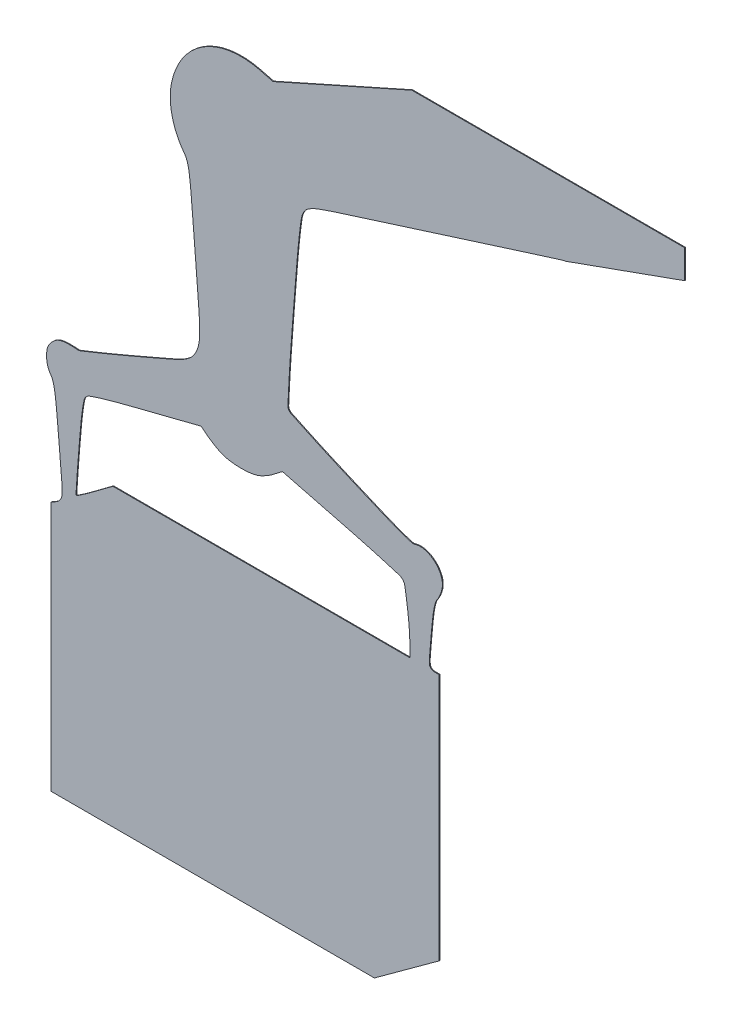
from build123d import *

# Parameters (mm, degrees)
BOSS_EXTRUDE1_DEPTH = 10
SCALE1_SCALE        = 0.046
CUT_EXTRUDE1_DEPTH  = 12692.615329405
CUT_EXTRUDE2_DEPTH  = 12517.928558279


with BuildPart() as part:
    # Sketch1 → Boss-Extrude1 (new body)
    with BuildSketch(Plane.XY):
        with BuildLine():
            Line((8013.7, 12087.9381558), (6413.5, 11374.2040232))
            Line((6413.5, 11374.2040232), (6240.4799498, 11418.3283698))
            ThreePointArc((6240.4799498, 11418.3283698), (6046.359984041, 11447.983061733), (5850.183499, 11439.2224352))
            ThreePointArc((5850.183499, 11439.2224352), (5665.088909871, 11392.106426099), (5494.1407008, 11306.9205408))
            ThreePointArc((5494.1407008, 11306.9205408), (5345.328560712, 11187.669304739), (5225.1613302, 11039.5958532))
            ThreePointArc((5225.1613302, 11039.5958532), (5135.482400316, 10865.681366374), (5081.728978, 10677.5348044))
            ThreePointArc((5081.728978, 10677.5348044), (5070.59567271, 10588.705653864), (5069.2278854, 10499.191981))
            ThreePointArc((5069.2278854, 10499.191981), (5077.452147154, 10407.059650706), (5094.7620228, 10316.1950648))
            ThreePointArc((5094.7620228, 10316.1950648), (5121.033047908, 10227.302344557), (5155.9620528, 10141.4417186))
            ThreePointArc((5155.9620528, 10141.4417186), (5198.337440796, 10061.957763243), (5249.023792, 9987.497932))
            ThreePointArc((5249.023792, 9987.497932), (5273.045317341, 9949.461029077), (5290.0090542, 9907.7948402))
            ThreePointArc((5290.0090542, 9907.7948402), (5305.17852601, 9850.504915282), (5315.782231, 9792.1970272))
            ThreePointArc((5315.782231, 9792.1970272), (5329.167785357, 9687.048159554), (5339.6477408, 9581.5700672))
            ThreePointArc((5339.6477408, 9581.5700672), (5363.840138018, 9294.925199538), (5387.437409, 9008.2307262))
            ThreePointArc((5387.437409, 9008.2307262), (5416.286522533, 8647.747745028), (5444.2516464, 8287.1951096))
            ThreePointArc((5444.2516464, 8287.1951096), (5451.43971584, 8162.289482831), (5453.9529224, 8037.2024422))
            ThreePointArc((5453.9529224, 8037.2024422), (5449.926817768, 7965.282930235), (5437.7011642, 7894.2958954))
            ThreePointArc((5437.7011642, 7894.2958954), (5418.187849305, 7832.911229395), (5389.1534584, 7775.4147006))
            ThreePointArc((5389.1534584, 7775.4147006), (5360.432474359, 7735.42584984), (5326.0360586, 7700.1995856))
            ThreePointArc((5326.0360586, 7700.1995856), (5283.671683469, 7667.035926907), (5237.7633878, 7638.9824614))
            ThreePointArc((5237.7633878, 7638.9824614), (5156.323701806, 7597.538218662), (5073.2948572, 7559.3772612))
            ThreePointArc((5073.2948572, 7559.3772612), (4841.842272606, 7458.942619321), (4610.1, 7359.1782204))
            ThreePointArc((4610.1, 7359.1782204), (4472.546974341, 7300.543613169), (4334.7457628, 7242.4946844))
            ThreePointArc((4334.7457628, 7242.4946844), (4215.84703669, 7193.169525037), (4096.623125, 7144.6356472))
            ThreePointArc((4096.623125, 7144.6356472), (3992.875825461, 7102.918226399), (3889.049118, 7061.3988312))
            ThreePointArc((3889.049118, 7061.3988312), (3875.172107017, 7057.616370579), (3860.8, 7057.0498178))
            ThreePointArc((3860.8, 7057.0498178), (3788.686277732, 7060.729199963), (3716.4796638, 7061.0921008))
            ThreePointArc((3716.4796638, 7061.0921008), (3668.670063023, 7056.686907952), (3622.0311354, 7045.2862904))
            ThreePointArc((3622.0311354, 7045.2862904), (3584.941382024, 7029.068759948), (3551.7445348, 7005.9035396))
            ThreePointArc((3551.7445348, 7005.9035396), (3517.965532838, 6973.097636949), (3488.5768938, 6936.30693))
            ThreePointArc((3488.5768938, 6936.30693), (3469.492867754, 6902.045915317), (3457.8050478, 6864.610477))
            ThreePointArc((3457.8050478, 6864.610477), (3451.280738568, 6818.108248058), (3450.4111078, 6771.1586192))
            ThreePointArc((3450.4111078, 6771.1586192), (3455.262622431, 6723.510334197), (3465.7417858, 6676.7761562))
            ThreePointArc((3465.7417858, 6676.7761562), (3480.830700287, 6637.788146337), (3502.5934266, 6602.0932728))
            ThreePointArc((3502.5934266, 6602.0932728), (3521.051484979, 6571.93189785), (3533.978962, 6539.018545))
            ThreePointArc((3533.978962, 6539.018545), (3546.631358446, 6490.474104554), (3556.1690624, 6441.2229316))
            ThreePointArc((3556.1690624, 6441.2229316), (3567.919821071, 6360.028912081), (3577.1121752, 6278.505604))
            ThreePointArc((3577.1121752, 6278.505604), (3592.554761707, 6115.030510805), (3607.2203446, 5951.4838806))
            ThreePointArc((3607.2203446, 5951.4838806), (3628.747440784, 5701.649294583), (3649.7228504, 5451.7677858))
            ThreePointArc((3649.7228504, 5451.7677858), (3653.303495344, 5384.795036587), (3652.9653382, 5317.72749))
            ThreePointArc((3652.9653382, 5317.72749), (3647.178742206, 5282.142183378), (3632.6405122, 5249.1506904))
            ThreePointArc((3632.6405122, 5249.1506904), (3610.181824588, 5220.557208509), (3581.4, 5198.3404034))
            Line((3581.4, 5198.3404034), (3505.2, 5153.3279712))
            Line((3505.2, 5153.3279712), (3505.2, 3516.4639856))
            Line((3505.2, 3516.4639856), (3505.2, 1879.6))
            Line((3505.2, 1879.6), (5622.395664, 1879.6))
            Line((5622.395664, 1879.6), (7739.5913026, 1879.6))
            Line((7739.5913026, 1879.6), (8162.395664, 2187.7570164))
            Line((8162.395664, 2187.7570164), (8585.2, 2495.9140582))
            Line((8585.2, 2495.9140582), (8585.2, 4118.1570164))
            Line((8585.2, 4118.1570164), (8585.2, 5740.4))
            Line((8585.2, 5740.4), (8521.7, 5740.4))
            ThreePointArc((8521.7, 5740.4), (8499.621736439, 5744.256845044), (8480.1586556, 5755.370506))
            ThreePointArc((8480.1586556, 5755.370506), (8466.798224941, 5771.937972142), (8460.9593798, 5792.4047728))
            ThreePointArc((8460.9593798, 5792.4047728), (8459.307495931, 5836.167616977), (8461.140685, 5879.9232414))
            ThreePointArc((8461.140685, 5879.9232414), (8473.890569662, 6032.434200774), (8487.169589, 6184.9))
            ThreePointArc((8487.169589, 6184.9), (8495.074777487, 6268.097332276), (8503.9980034, 6351.191641))
            ThreePointArc((8503.9980034, 6351.191641), (8511.311435418, 6405.689023868), (8520.831066, 6459.8446114))
            ThreePointArc((8520.831066, 6459.8446114), (8529.476237188, 6497.595691068), (8540.430214, 6534.7426074))
            ThreePointArc((8540.430214, 6534.7426074), (8551.399303065, 6561.381231615), (8566.1292482, 6586.1393804))
            ThreePointArc((8566.1292482, 6586.1393804), (8576.765103953, 6602.739954352), (8586.0423402, 6620.1363152))
            ThreePointArc((8586.0423402, 6620.1363152), (8595.916066382, 6641.825237208), (8604.7919598, 6663.9412568))
            ThreePointArc((8604.7919598, 6663.9412568), (8612.789637678, 6686.822845287), (8619.7438984, 6710.042841))
            ThreePointArc((8619.7438984, 6710.042841), (8624.615343178, 6730.497311193), (8628.0625, 6751.2393804))
            ThreePointArc((8628.0625, 6751.2393804), (8627.766889761, 6816.992622416), (8609.991162, 6880.2982282))
            ThreePointArc((8609.991162, 6880.2982282), (8575.08984436, 6941.510082371), (8527.6889898, 6993.6459822))
            ThreePointArc((8527.6889898, 6993.6459822), (8470.459185423, 7033.829045105), (8405.789259, 7060.4322342))
            ThreePointArc((8405.789259, 7060.4322342), (8341.758979586, 7069.433837567), (8277.7284788, 7060.433809))
            ThreePointArc((8277.7284788, 7060.433809), (8246.325518454, 7056.171018469), (8215.0088176, 7061.0271022))
            ThreePointArc((8215.0088176, 7061.0271022), (8142.617224989, 7084.426898938), (8070.9304926, 7109.9044492))
            ThreePointArc((8070.9304926, 7109.9044492), (7956.791154889, 7153.694426638), (7843.5905612, 7199.8569236))
            ThreePointArc((7843.5905612, 7199.8569236), (7635.475694259, 7287.737711921), (7427.6985812, 7376.4141016))
            ThreePointArc((7427.6985812, 7376.4141016), (7276.698060485, 7441.745559624), (7126.0979398, 7507.9947884))
            ThreePointArc((7126.0979398, 7507.9947884), (6996.659110434, 7566.139903041), (6867.7758758, 7625.5063644))
            ThreePointArc((6867.7758758, 7625.5063644), (6756.954102408, 7677.400860526), (6646.2949878, 7729.6413098))
            ThreePointArc((6646.2949878, 7729.6413098), (6631.295110686, 7739.554392533), (6619.6560266, 7753.258306))
            ThreePointArc((6619.6560266, 7753.258306), (6610.70551698, 7773.762227935), (6608.265422, 7796.0011212))
            ThreePointArc((6608.265422, 7796.0011212), (6613.799150605, 7920.600877676), (6619.9587946, 8045.1712604))
            ThreePointArc((6619.9587946, 8045.1712604), (6629.606037532, 8214.837445524), (6640.9083844, 8384.4014176))
            ThreePointArc((6640.9083844, 8384.4014176), (6659.557083807, 8639.604717722), (6678.9753898, 8894.7506128))
            ThreePointArc((6678.9753898, 8894.7506128), (6701.895117406, 9185.045509683), (6725.5817228, 9475.2788396))
            ThreePointArc((6725.5817228, 9475.2788396), (6740.03572912, 9636.309982298), (6756.6673858, 9797.1307994))
            ThreePointArc((6756.6673858, 9797.1307994), (6768.823209225, 9898.593531999), (6782.8884662, 9999.8092358))
            ThreePointArc((6782.8884662, 9999.8092358), (6793.251642243, 10044.911696265), (6810.5265364, 10087.8442642))
            ThreePointArc((6810.5265364, 10087.8442642), (6838.953243398, 10129.802521095), (6877.5131182, 10162.6918666))
            ThreePointArc((6877.5131182, 10162.6918666), (6937.289587601, 10196.592027706), (7000.4666442, 10223.6310132))
            ThreePointArc((7000.4666442, 10223.6310132), (7133.867205826, 10270.587865527), (7268.1976556, 10314.814397))
            ThreePointArc((7268.1976556, 10314.814397), (7926.652624623, 10524.024074559), (8585.2, 10732.9426946))
            Line((8585.2, 10732.9426946), (9724.6877134, 11094.0807074))
            ThreePointArc((9724.6877134, 11094.0807074), (9882.121991335, 11143.830554107), (10039.6334894, 11193.335373))
            ThreePointArc((10039.6334894, 11193.335373), (10126.434710134, 11220.461411642), (10213.2817578, 11247.4403702))
            ThreePointArc((10213.2817578, 11247.4403702), (10226.888408223, 11250.626221539), (10240.8073822, 11251.8723146))
            ThreePointArc((10240.8073822, 11251.8723146), (10251.605287665, 11249.71452924), (10260.5055902, 11243.2310568))
            ThreePointArc((10260.5055902, 11243.2310568), (10348.52857854, 11143.737186565), (10436.4002346, 11044.1096364))
            ThreePointArc((10436.4002346, 11044.1096364), (10573.529611947, 10887.775517933), (10710.0413434, 10730.9017792))
            ThreePointArc((10710.0413434, 10730.9017792), (11017.796401299, 10375.669808905), (11325.3922844, 10020.3))
            Line((11325.3922844, 10020.3), (11488.731023, 9831.6198846))
            Line((11488.731023, 9831.6198846), (11633.909041, 9664.1613168))
            Line((11633.909041, 9664.1613168), (11756.8074744, 9522.5883462))
            ThreePointArc((11756.8074744, 9522.5883462), (11773.014929443, 9504.045912955), (11789.3396166, 9485.6066066))
            ThreePointArc((11789.3396166, 9485.6066066), (11801.471954744, 9470.651088998), (11812.1705336, 9454.6385456))
            ThreePointArc((11812.1705336, 9454.6385456), (11818.547613602, 9441.226414023), (11822.1640874, 9426.8224722))
            ThreePointArc((11822.1640874, 9426.8224722), (11823.219249135, 9410.444508738), (11821.5623614, 9394.1164416))
            ThreePointArc((11821.5623614, 9394.1164416), (11816.411467152, 9369.864948573), (11810.0345968, 9345.9066066))
            ThreePointArc((11810.0345968, 9345.9066066), (11789.788692272, 9253.989134012), (11782.334322, 9160.1640266))
            ThreePointArc((11782.334322, 9160.1640266), (11775.675639859, 8484.016465428), (11769.9324672, 7807.8605082))
            ThreePointArc((11769.9324672, 7807.8605082), (11765.002192197, 7126.326371667), (11760.865226, 6444.786958))
            ThreePointArc((11760.865226, 6444.786958), (11766.994080455, 6363.849098465), (11786.1075936, 6284.9620046))
            ThreePointArc((11786.1075936, 6284.9620046), (11801.273658631, 6248.022209383), (11821.5014522, 6213.5926528))
            ThreePointArc((11821.5014522, 6213.5926528), (11847.009980231, 6181.136931264), (11876.4599402, 6152.2101492))
            ThreePointArc((11876.4599402, 6152.2101492), (11907.352950793, 6129.01489143), (11941.116199, 6110.2414752))
            ThreePointArc((11941.116199, 6110.2414752), (11972.235832928, 6099.603637225), (12004.9254186, 6096))
            ThreePointArc((12004.9254186, 6096), (12022.237348825, 6094.365139274), (12038.937187, 6089.5183772))
            ThreePointArc((12038.937187, 6089.5183772), (12049.714298184, 6082.264416243), (12056.4683686, 6071.167182))
            ThreePointArc((12056.4683686, 6071.167182), (12061.626567073, 6051.31204068), (12063.6880646, 6030.9016542))
            ThreePointArc((12063.6880646, 6030.9016542), (12064.671993978, 5976.025775463), (12065, 5921.1420566))
            Line((12065, 5921.1420566), (12065, 5746.2841132))
            Line((12065, 5746.2841132), (11728.45, 5735.6247238))
            ThreePointArc((11728.45, 5735.6247238), (11639.409912361, 5732.265376868), (11550.4169804, 5727.8291082))
            ThreePointArc((11550.4169804, 5727.8291082), (11492.78719336, 5723.401344301), (11435.3917342, 5716.5779496))
            ThreePointArc((11435.3917342, 5716.5779496), (11392.482951355, 5709.191580544), (11350.1206576, 5699.1338392))
            ThreePointArc((11350.1206576, 5699.1338392), (11311.76695197, 5687.09353885), (11274.490913, 5672.044536))
            ThreePointArc((11274.490913, 5672.044536), (11212.826297903, 5640.813741429), (11154.242868, 5604.1276538))
            ThreePointArc((11154.242868, 5604.1276538), (11097.403659938, 5561.248873097), (11044.3142334, 5513.8062952))
            ThreePointArc((11044.3142334, 5513.8062952), (10995.201036709, 5461.991489912), (10950.5393892, 5406.2939372))
            ThreePointArc((10950.5393892, 5406.2939372), (10911.772972589, 5348.394179623), (10878.3064628, 5287.2778176))
            Line((10878.3064628, 5287.2778176), (10807.7, 5143.5))
            Line((10807.7, 5143.5), (10800.079111, 4298.95))
            Line((10800.079111, 4298.95), (10792.4582474, 3454.4))
            Line((10792.4582474, 3454.4), (10695.5545296, 3454.4))
            ThreePointArc((10695.5545296, 3454.4), (10673.210222905, 3453.506848803), (10651.0084922, 3450.8331034))
            ThreePointArc((10651.0084922, 3450.8331034), (10628.667947463, 3446.360708838), (10606.728723, 3440.2147604))
            ThreePointArc((10606.728723, 3440.2147604), (10585.996334601, 3432.651714483), (10565.9141488, 3423.5009))
            ThreePointArc((10565.9141488, 3423.5009), (10548.275509695, 3413.484445011), (10531.7254186, 3401.756468))
            Line((10531.7254186, 3401.756468), (10464.8, 3349.112936))
            Line((10464.8, 3349.112936), (10464.8, 2906.3587796))
            Line((10464.8, 2906.3587796), (10464.8, 2463.6046486))
            Line((10464.8, 2463.6046486), (13671.55, 2470.052337))
            Line((13671.55, 2470.052337), (16878.3, 2476.5))
            Line((16878.3, 2476.5), (16878.3, 2904.191804))
            Line((16878.3, 2904.191804), (16878.3, 3331.8836334))
            Line((16878.3, 3331.8836334), (16807.0335944, 3393.141804))
            ThreePointArc((16807.0335944, 3393.141804), (16789.805423154, 3406.726225623), (16771.490206, 3418.8051004))
            ThreePointArc((16771.490206, 3418.8051004), (16752.1689091, 3429.328105309), (16732.033211, 3438.1937586))
            ThreePointArc((16732.033211, 3438.1937586), (16711.729000447, 3445.142774677), (16690.9026862, 3450.3210394))
            ThreePointArc((16690.9026862, 3450.3210394), (16670.747066545, 3453.377695343), (16650.3866382, 3454.4))
            Line((16650.3866382, 3454.4), (16565.0060368, 3454.4))
            Line((16565.0060368, 3454.4), (16556.5530184, 4288.8790016))
            Line((16556.5530184, 4288.8790016), (16548.1, 5123.3579778))
            Line((16548.1, 5123.3579778), (16459.2, 5297.5729456))
            ThreePointArc((16459.2, 5297.5729456), (16393.970241534, 5406.129975299), (16314.3836526, 5504.646598))
            ThreePointArc((16314.3836526, 5504.646598), (16228.696609606, 5581.29891545), (16130.3999972, 5640.9279612))
            ThreePointArc((16130.3999972, 5640.9279612), (16010.404259301, 5688.227315854), (15884.542907, 5716.4252956))
            ThreePointArc((15884.542907, 5716.4252956), (15717.441602781, 5734.398648806), (15549.4836584, 5740.4))
            Line((15549.4836584, 5740.4), (15265.4, 5740.4))
            Line((15265.4, 5740.4), (15265.4, 5904.5209824))
            Line((15265.4, 5904.5209824), (15265.4, 6068.6419648))
            Line((15265.4, 6068.6419648), (15365.7226086, 6095.6560332))
            ThreePointArc((15365.7226086, 6095.6560332), (15388.472859271, 6102.788960928), (15410.5661816, 6111.7520894))
            ThreePointArc((15410.5661816, 6111.7520894), (15432.236417154, 6122.623700965), (15452.9987104, 6135.142416))
            ThreePointArc((15452.9987104, 6135.142416), (15472.01252463, 6148.758650972), (15489.8749892, 6163.8536616))
            ThreePointArc((15489.8749892, 6163.8536616), (15504.839594685, 6179.086560043), (15518.1226086, 6195.8060742))
            ThreePointArc((15518.1226086, 6195.8060742), (15539.452162435, 6235.505668493), (15550.2305708, 6279.2644798))
            ThreePointArc((15550.2305708, 6279.2644798), (15558.562142107, 6366.481581122), (15563.3096912, 6453.9670006))
            ThreePointArc((15563.3096912, 6453.9670006), (15567.566790383, 6618.991725036), (15569.2131592, 6784.06314))
            ThreePointArc((15569.2131592, 6784.06314), (15569.953342364, 7262.285296995), (15570.2, 7740.5079632))
            ThreePointArc((15570.2, 7740.5079632), (15569.201322813, 8290.823937352), (15566.2050118, 8841.1326606))
            ThreePointArc((15566.2050118, 8841.1326606), (15559.936243212, 9048.055940888), (15544.1482868, 9254.4712548))
            ThreePointArc((15544.1482868, 9254.4712548), (15522.542584413, 9393.274017752), (15485.8152056, 9528.8620446))
            ThreePointArc((15485.8152056, 9528.8620446), (15429.20715326, 9681.530775028), (15361.913396, 9829.8))
            ThreePointArc((15361.913396, 9829.8), (15330.041020842, 9890.913768027), (15295.8501804, 9950.7613024))
            ThreePointArc((15295.8501804, 9950.7613024), (15263.300606357, 10001.965253413), (15227.9328156, 10051.2647336))
            ThreePointArc((15227.9328156, 10051.2647336), (15185.607808221, 10104.255502838), (15140.828113, 10155.188859))
            ThreePointArc((15140.828113, 10155.188859), (15076.9895261, 10223.14666278), (15011.8922012, 10289.8996894))
            ThreePointArc((15011.8922012, 10289.8996894), (14942.019708299, 10358.978162157), (14870.9251222, 10426.7982218))
            ThreePointArc((14870.9251222, 10426.7982218), (14821.428489438, 10470.653513786), (14769.566092, 10511.6839296))
            ThreePointArc((14769.566092, 10511.6839296), (14719.580647315, 10546.568414462), (14667.4574824, 10578.1698012))
            ThreePointArc((14667.4574824, 10578.1698012), (14598.474047126, 10615.641921358), (14528.37836, 10650.989747))
            ThreePointArc((14528.37836, 10650.989747), (14436.385896336, 10693.412411794), (14342.7936156, 10732.1781292))
            ThreePointArc((14342.7936156, 10732.1781292), (14255.550037724, 10763.764087451), (14166.8031878, 10790.840115))
            ThreePointArc((14166.8031878, 10790.840115), (14078.522226444, 10812.843634457), (13989.2088008, 10830.1870772))
            ThreePointArc((13989.2088008, 10830.1870772), (13894.308535835, 10843.865098565), (13798.8905378, 10853.2754232))
            ThreePointArc((13798.8905378, 10853.2754232), (13747.506006035, 10858.654666469), (13696.510072, 10866.944484))
            ThreePointArc((13696.510072, 10866.944484), (13661.709384014, 10876.55887704), (13628.884223, 10891.593279))
            ThreePointArc((13628.884223, 10891.593279), (13590.249794058, 10915.587637602), (13553.998927, 10943.050758))
            ThreePointArc((13553.998927, 10943.050758), (13472.90780803, 11011.288348759), (13392.4905378, 11080.3187842))
            Line((13392.4905378, 11080.3187842), (13249.18356, 11204.4861508))
            Line((13249.18356, 11204.4861508), (12978.5872254, 11438.7763858))
            Line((12978.5872254, 11438.7763858), (12661.0677182, 11713.6338244))
            Line((12661.0677182, 11713.6338244), (12331.7, 11998.6858578))
            ThreePointArc((12331.7, 11998.6858578), (12139.965515321, 12165.362002787), (11948.9830108, 12332.899261))
            ThreePointArc((11948.9830108, 12332.899261), (11819.346864421, 12448.695864363), (11691.279132, 12566.2247532))
            ThreePointArc((11691.279132, 12566.2247532), (11602.500209131, 12650.048325947), (11514.9817452, 12735.1870772))
            ThreePointArc((11514.9817452, 12735.1870772), (11478.246452113, 12776.301810119), (11446.9252392, 12821.6767442))
            ThreePointArc((11446.9252392, 12821.6767442), (11369.950543409, 12934.783861737), (11280.8380428, 13038.5975702))
            ThreePointArc((11280.8380428, 13038.5975702), (11184.469460283, 13126.844315827), (11077.6061404, 13202.041541))
            ThreePointArc((11077.6061404, 13202.041541), (10963.57284339, 13261.965467117), (10842.7128586, 13306.5449896))
            ThreePointArc((10842.7128586, 13306.5449896), (10714.383776247, 13336.198752676), (10583.3984166, 13350.0021798))
            ThreePointArc((10583.3984166, 13350.0021798), (10536.038914249, 13351.400670377), (10488.6587788, 13351.4323522))
            ThreePointArc((10488.6587788, 13351.4323522), (10443.398360002, 13350.061412745), (10398.2079564, 13347.195683))
            ThreePointArc((10398.2079564, 13347.195683), (10357.68465063, 13343.22099371), (10317.329759, 13337.797048))
            ThreePointArc((10317.329759, 13337.797048), (10284.481288182, 13331.693661966), (10252.0934658, 13323.489863))
            ThreePointArc((10252.0934658, 13323.489863), (10182.228404531, 13300.037565448), (10114.6708552, 13270.5907562))
            ThreePointArc((10114.6708552, 13270.5907562), (10042.253693729, 13232.295546278), (9972.416047, 13189.4764912))
            ThreePointArc((9972.416047, 13189.4764912), (9905.317892656, 13142.22442606), (9841.3534948, 13090.8096832))
            ThreePointArc((9841.3534948, 13090.8096832), (9787.199122165, 13040.176405817), (9737.5943678, 12985.0783732))
            ThreePointArc((9737.5943678, 12985.0783732), (9717.010826365, 12959.83175702), (9696.7305938, 12934.3408572))
            ThreePointArc((9696.7305938, 12934.3408572), (9678.551836387, 12910.830580975), (9660.7451692, 12887.0372434))
            ThreePointArc((9660.7451692, 12887.0372434), (9646.164389344, 12866.982868515), (9631.8230782, 12846.7565518))
            ThreePointArc((9631.8230782, 12846.7565518), (9626.94645639, 12838.596204052), (9623.2943678, 12829.8192476))
            ThreePointArc((9623.2943678, 12829.8192476), (9617.670838437, 12820.135632542), (9608.6668126, 12813.4780052))
            ThreePointArc((9608.6668126, 12813.4780052), (9377.655249092, 12706.833101569), (9146.600833, 12600.2810732))
            ThreePointArc((9146.600833, 12600.2810732), (8887.480430894, 12481.451095729), (8627.9063408, 12363.6154556))
            ThreePointArc((8627.9063408, 12363.6154556), (8320.964303782, 12225.417802094), (8013.7, 12087.9381558))
        make_face()
        with BuildLine():
            Line((6416.8526222, 6925.376421), (6535.7005176, 7016.095061))
            Line((6535.7005176, 7016.095061), (7300.1002588, 6820.8398762))
            ThreePointArc((7300.1002588, 6820.8398762), (7458.579539089, 6779.836401399), (7616.802394, 6737.854317))
            ThreePointArc((7616.802394, 6737.854317), (7742.343405078, 6703.309336525), (7867.4555884, 6667.2421392))
            ThreePointArc((7867.4555884, 6667.2421392), (7967.364623775, 6637.434917609), (8067.081275, 6606.9902912))
            ThreePointArc((8067.081275, 6606.9902912), (8088.295600148, 6597.454472663), (8106.5512748, 6583.042333))
            ThreePointArc((8106.5512748, 6583.042333), (8126.910796086, 6554.865450606), (8137.7779332, 6521.84497))
            ThreePointArc((8137.7779332, 6521.84497), (8155.189726766, 6411.148017877), (8170.8195994, 6300.1854438))
            ThreePointArc((8170.8195994, 6300.1854438), (8185.007733473, 6180.751757555), (8195.9289726, 6060.9751526))
            ThreePointArc((8195.9289726, 6060.9751526), (8202.131438279, 5954.069958625), (8204.2, 5847.0049684))
            Line((8204.2, 5847.0049684), (8204.2, 5740.4))
            Line((8204.2, 5740.4), (6261.0664466, 5740.4))
            Line((6261.0664466, 5740.4), (4317.9328932, 5740.4))
            Line((4317.9328932, 5740.4), (4083.0164466, 5565.386888))
            ThreePointArc((4083.0164466, 5565.386888), (4037.779527536, 5531.964686598), (3992.2777406, 5498.9039882))
            ThreePointArc((3992.2777406, 5498.9039882), (3953.507362828, 5471.353921392), (3914.3789886, 5444.3147146))
            ThreePointArc((3914.3789886, 5444.3147146), (3880.463745815, 5421.291910495), (3846.468177, 5398.3878824))
            ThreePointArc((3846.468177, 5398.3878824), (3842.536562649, 5397.357331357), (3838.8141918, 5398.9893798))
            ThreePointArc((3838.8141918, 5398.9893798), (3836.164771937, 5402.850949304), (3835.4262382, 5407.4754182))
            ThreePointArc((3835.4262382, 5407.4754182), (3840.551947587, 5488.083464809), (3845.7389176, 5568.6875926))
            ThreePointArc((3845.7389176, 5568.6875926), (3851.870961044, 5659.571419759), (3858.4982266, 5750.4204778))
            ThreePointArc((3858.4982266, 5750.4204778), (3866.784105519, 5857.517817519), (3875.4274282, 5964.5869024))
            ThreePointArc((3875.4274282, 5964.5869024), (3887.549774325, 6106.605220426), (3900.5044164, 6248.5500378))
            ThreePointArc((3900.5044164, 6248.5500378), (3909.526760049, 6332.907838565), (3920.6727276, 6417.0113976))
            ThreePointArc((3920.6727276, 6417.0113976), (3929.539565718, 6471.183344431), (3940.337306, 6525.0036886))
            ThreePointArc((3940.337306, 6525.0036886), (3949.324729372, 6551.066332363), (3964.0729456, 6574.3585048))
            ThreePointArc((3964.0729456, 6574.3585048), (3985.536033452, 6594.53420239), (4011.6207804, 6608.2202862))
            ThreePointArc((4011.6207804, 6608.2202862), (4081.250395539, 6632.477955721), (4151.4563148, 6655.0134108))
            ThreePointArc((4151.4563148, 6655.0134108), (4260.064212229, 6687.197719596), (4369.3057648, 6717.1608354))
            ThreePointArc((4369.3057648, 6717.1608354), (4554.67103105, 6765.515082822), (4740.2597092, 6813.0046366))
            Line((4740.2597092, 6813.0046366), (5473.7, 6998.8611356))
            Line((5473.7, 6998.8611356), (5549.9, 6937.2031944))
            ThreePointArc((5549.9, 6937.2031944), (5567.840685189, 6923.325400482), (5586.371987, 6910.2467078))
            ThreePointArc((5586.371987, 6910.2467078), (5609.789482889, 6894.872658089), (5633.56125, 6880.05228))
            ThreePointArc((5633.56125, 6880.05228), (5658.237160166, 6865.458401344), (5683.2466726, 6851.4439044))
            ThreePointArc((5683.2466726, 6851.4439044), (5705.275070215, 6839.940414726), (5727.7, 6829.2304614))
            ThreePointArc((5727.7, 6829.2304614), (5776.141249244, 6810.700468138), (5826.5112832, 6798.3402514))
            ThreePointArc((5826.5112832, 6798.3402514), (5889.783445372, 6789.12279161), (5953.5318572, 6784.1762716))
            ThreePointArc((5953.5318572, 6784.1762716), (6019.946941625, 6783.457244613), (6086.2648404, 6787.1201316))
            ThreePointArc((6086.2648404, 6787.1201316), (6145.294301088, 6795.069180174), (6203.3523634, 6808.3705336))
            ThreePointArc((6203.3523634, 6808.3705336), (6225.997855135, 6815.660752842), (6247.9782584, 6824.7617124))
            ThreePointArc((6247.9782584, 6824.7617124), (6276.791034354, 6838.685834248), (6305.1121802, 6853.5844894))
            ThreePointArc((6305.1121802, 6853.5844894), (6335.05739477, 6870.653597342), (6364.414373, 6888.7156612))
            ThreePointArc((6364.414373, 6888.7156612), (6391.016969148, 6906.497537013), (6416.8526222, 6925.376421))
        make_face(mode=Mode.SUBTRACT)
    extrude(amount=BOSS_EXTRUDE1_DEPTH)


with BuildPart() as part_1:
    # Scale1: scaled about (10325.94700664, 6628.792946835, 5)
    add(part.part.scale(SCALE1_SCALE).moved(Location((9850.953444335, 6323.868471281, 4.77))))

    # Sketch2 → Cut-Extrude1 (cut, through all)
    with BuildSketch(Plane.XY.offset(5.23)):
        Polygon((10322.030585051, 6841.454596388), (10418.113093066, 6875.893311776), (10558.920535674, 6841.454596388), (10661.067236148, 6685.319867261), (10677.259637031, 6410.049052258), (10292.028094317, 6387.388373274), align=None)
    extrude(amount=-CUT_EXTRUDE1_DEPTH, mode=Mode.SUBTRACT)

    # Sketch3 → Cut-Extrude2 (cut, through all)
    with BuildSketch(Plane.XY.offset(5.23)):
        Polygon((10229.483754597, 6884.339081299), (10393.699439041, 6884.339081299), (10393.699439041, 6867.142760818), (10432.437229917, 6872.268542042), (10390.816611652, 6955.64025073), (10244.687795171, 6944.811061652), align=None)
    extrude(amount=-CUT_EXTRUDE2_DEPTH, mode=Mode.SUBTRACT)


solid = part_1.part
